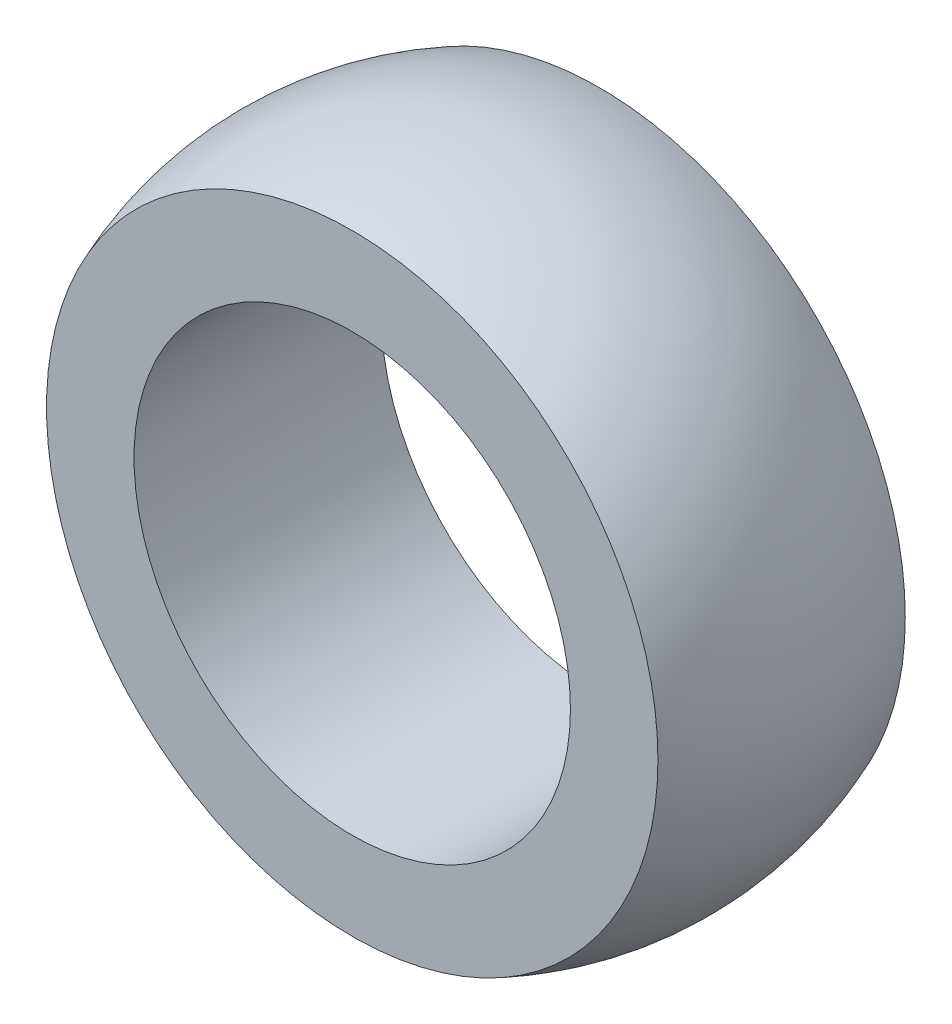
from build123d import *

# Parameters (mm, degrees)
CUT_EXTRUDE2_DEPTH      = 21.784609691
CUT_EXTRUDE2_DEPTH_BACK = 21.784609691
SKETCH4_OUTSIDE_W       = 34.314
SKETCH4_OUTSIDE_H       = 34.314
SKETCH4_OUTSIDE_W_2     = 29.129985156
SKETCH4_OUTSIDE_H_2     = 9
SKETCH5_R               = 7.94
CUT_EXTRUDE3_DEPTH      = 30


with BuildPart() as part:
    # Sketch1 → Revolve1 (revolve)
    with BuildSketch(Plane.XY):
        with BuildLine():
            Line((0, 12), (0, -12))
            ThreePointArc((0, -12), (12, 0), (0, 12))
        make_face()
    revolve(axis=Axis((0, 12, 0), (0, -1, 0)))

    # Sketch4 outside → Cut-Extrude2 (cut, two sides: drawn at the far end of the back side and taken through both)
    with BuildSketch(Plane(origin=(0, 0, 0), x_dir=(1, 0, 0), z_dir=(0, 1, 0)).offset(-CUT_EXTRUDE2_DEPTH_BACK)):
        Rectangle(SKETCH4_OUTSIDE_W, SKETCH4_OUTSIDE_H)
        Rectangle(SKETCH4_OUTSIDE_W_2, SKETCH4_OUTSIDE_H_2, mode=Mode.SUBTRACT)
    extrude(amount=CUT_EXTRUDE2_DEPTH + CUT_EXTRUDE2_DEPTH_BACK, mode=Mode.SUBTRACT)

    # Sketch5 → Cut-Extrude3 (cut)
    with BuildSketch(Plane.XY.offset(4.5)):
        Circle(SKETCH5_R)
    extrude(amount=-CUT_EXTRUDE3_DEPTH, mode=Mode.SUBTRACT)


solid = part.part
